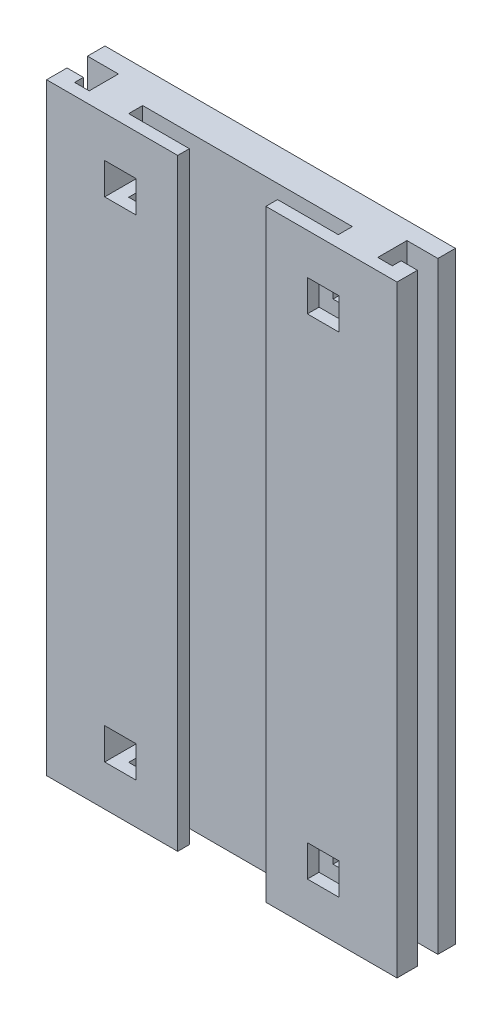
from build123d import *

# Parameters (mm, degrees)
SKETCH1_W           = 103.2
SKETCH1_H           = 60
BOSS_EXTRUDE1_DEPTH = 10
CUT_EXTRUDE6_DEPTH  = 108.936277497
SKETCH16_W          = 5.4
SKETCH16_H          = 5.4
CUT_EXTRUDE7_DEPTH  = 61.519087898


with BuildPart() as part:
    # Sketch1 → Boss-Extrude1 (new body)
    with BuildSketch(Plane(origin=(0, 0, 0), x_dir=(0, 1, 0), z_dir=(0, 0, 1))):
        Rectangle(SKETCH1_W, SKETCH1_H)
    extrude(amount=BOSS_EXTRUDE1_DEPTH)

    # Sketch14 → Cut-Extrude6 (cut, through all)
    with BuildSketch(Plane(origin=(0, 51.6, 0), x_dir=(-1, 0, 0), z_dir=(0, 1, 0))):
        Polygon((-30, 6.5), (-27.2, 6.5), (-27.2, 8), (-24.7, 8), (-24.7, 6), (-24.7, 3), (-30, 3), align=None)
        Polygon((30, 6.5), (30, 3), (24.7, 3), (24.7, 6), (24.7, 8), (27.2, 8), (27.2, 6.5), align=None)
        Polygon((17.95, 8), (7.55, 8), (7.55, 10), (-7.55, 10), (-7.55, 8), (-17.95, 8), (-17.95, 5.6), (17.95, 5.6), align=None)
    extrude(amount=-CUT_EXTRUDE6_DEPTH, mode=Mode.SUBTRACT)

    # Sketch16 → Cut-Extrude7 (cut, through all)
    with BuildSketch(Plane.XY.offset(10)):
        with Locations((17.35, -41.9)):
            Rectangle(SKETCH16_W, SKETCH16_H)
        with Locations((17.35, 41.9)):
            Rectangle(SKETCH16_W, SKETCH16_H)
        with Locations((-17.35, 41.9)):
            Rectangle(SKETCH16_W, SKETCH16_H)
        with Locations((-17.35, -41.9)):
            Rectangle(SKETCH16_W, SKETCH16_H)
    extrude(amount=-CUT_EXTRUDE7_DEPTH, mode=Mode.SUBTRACT)


solid = part.part
